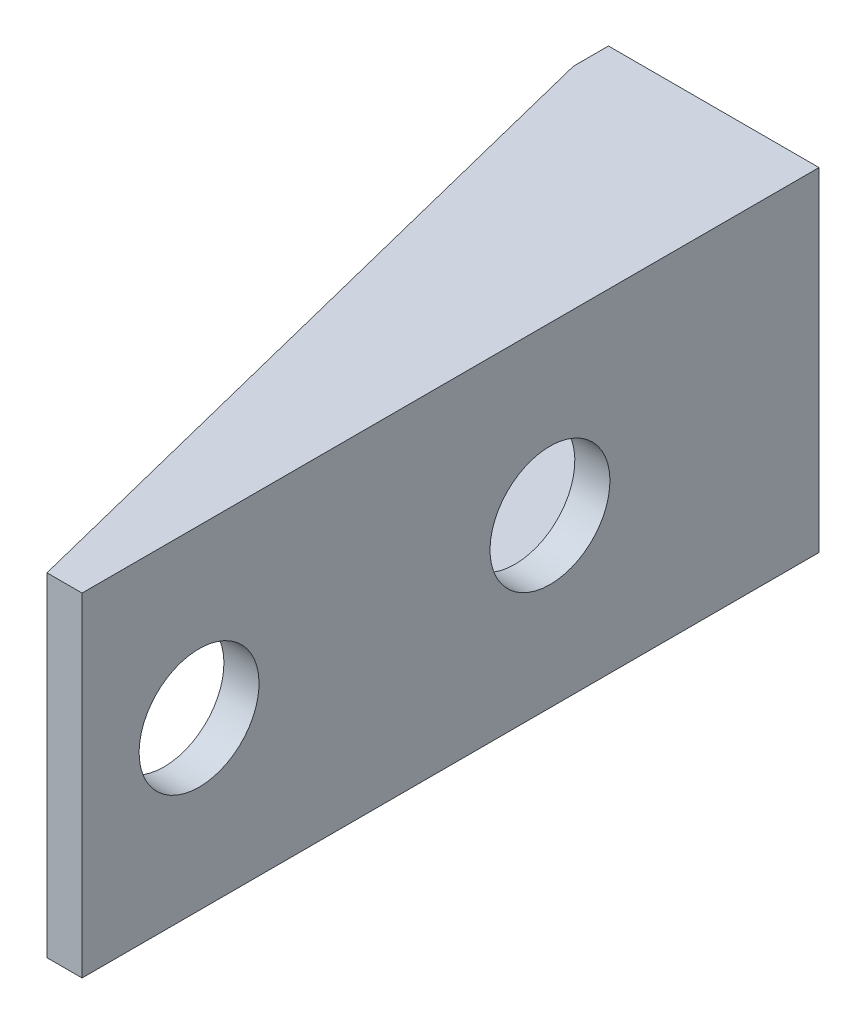
from build123d import *

# Parameters (mm, degrees)
SKETCH_1_W          = 7.2
SKETCH_1_H          = 5
EXTRUDE_1_DEPTH     = 1.2
SKETCH_2_R          = 1.85
CUT_EXTRUDE_1_DEPTH = 5.544227107
SKETCH_3_W          = 1.2
SKETCH_3_H          = 5
EXTRUDE_2_DEPTH     = 24
FILLET_1_R          = 0.3
SKETCH_4_R          = 2.05
CUT_EXTRUDE_2_DEPTH = 27.024795869
EXTRUDE_START       = 2
EXTRUDE_4_DEPTH     = 2
EXTRUDE_5_DEPTH     = 1.2


with BuildPart() as part:
    # 스케치1 → 보스-돌출1 (new body)
    with BuildSketch(Plane.XY):
        Rectangle(SKETCH_1_W, SKETCH_1_H)
    extrude(amount=EXTRUDE_1_DEPTH)

    # 스케치2 → 컷-돌출1 (cut, through all)
    with BuildSketch(Plane.XY.offset(1.2)):
        with Locations((-0.75, 0)):
            Circle(SKETCH_2_R)
    extrude(amount=-CUT_EXTRUDE_1_DEPTH, mode=Mode.SUBTRACT)

    # 스케치3 → 보스-돌출2 (add)
    with BuildSketch(Plane.XY.offset(1.2)):
        with Locations((3, 0)):
            Rectangle(SKETCH_3_W, SKETCH_3_H)
    extrude(amount=EXTRUDE_2_DEPTH)

    # 필렛1
    fillet_1_edges = [part.edges().sort_by_distance(p)[0] for p in [
        (2.4, 0, 1.2),
    ]]
    fillet(fillet_1_edges, radius=FILLET_1_R)

    # 스케치4 → 컷-돌출2 (cut, through all)
    with BuildSketch(Plane.ZY.offset(-2.4)):
        with Locations(Location((21.2, 0, 0), (0, 0, 270))):
            Circle(SKETCH_4_R)
        with Locations(Location((9.2, 0, 0), (0, 0, 270))):
            Circle(SKETCH_4_R)
    extrude(amount=-CUT_EXTRUDE_2_DEPTH, mode=Mode.SUBTRACT)

    # 스케치6 → 보스-돌출4 (add)
    with BuildSketch(Plane.XZ.offset(2.5).offset(EXTRUDE_START)):
        with BuildLine():
            Line((-3.6, 1.2), (-3.6, 0))
            Line((-3.6, 0), (3.6, 0))
            Line((3.6, 0), (3.6, 25.2))
            Line((3.6, 25.2), (2.4, 25.2))
            Line((2.4, 25.2), (2.4, 1.5))
            ThreePointArc((2.4, 1.5), (2.312132034, 1.287867966), (2.1, 1.2))
            Line((2.1, 1.2), (-3.6, 1.2))
        make_face()
    extrude_4 = extrude(amount=-EXTRUDE_4_DEPTH)

    # 대칭 복사1: 보스-돌출4 across plane
    add(extrude_4.mirror(Plane.ZX))

    # 스케치7 → 보스-돌출5 (add)
    with BuildSketch(Plane(origin=(0, -4.5, 0), x_dir=(-1, 0, 0), z_dir=(0, -1, 0))):
        Polygon((3.6, 0), (-3.6, 0), (-3.6, -25.2), (-2.4, -25.2), (3.6, -1.2), align=None)
    extrude_5 = extrude(amount=EXTRUDE_5_DEPTH)

    # 대칭 복사2: 보스-돌출5 across plane
    add(extrude_5.mirror(Plane.ZX))


solid = part.part
